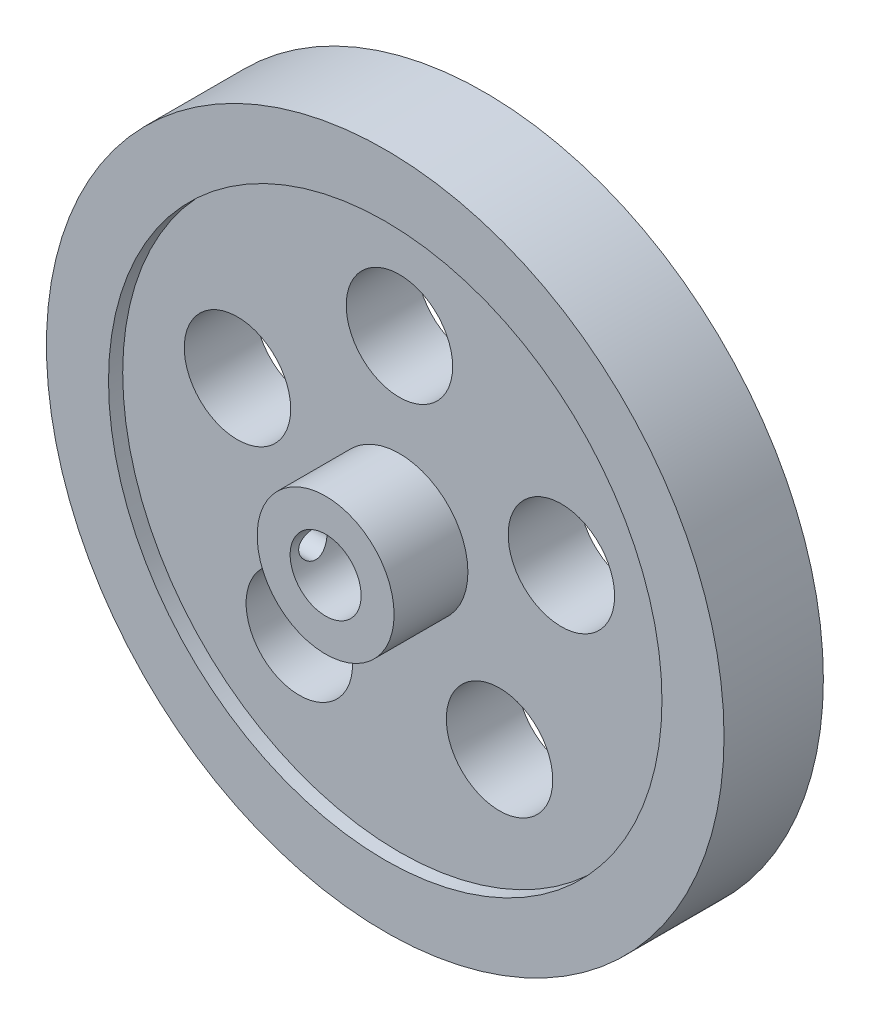
from build123d import *

# Parameters (mm, degrees)
SKETCH_1_R               = 47.75
EXTRUDE_1_DEPTH          = 14
SKETCH_2_R               = 9.65
EXTRUDE_2_DEPTH          = 8.4
SKETCH_3_R               = 5
CUT_EXTRUDE_1_DEPTH      = 22.4
CUT_EXTRUDE_2_REACH      = 73.147
CUT_EXTRUDE_2_END_RADIUS = 9.65
SKETCH_6_R               = 2
CUT_EXTRUDE_START        = -2
SKETCH_7_R               = 39
SKETCH_7_R_2             = 9.65
CUT_EXTRUDE_3_DEPTH      = 2
SKETCH_8_R               = 39
SKETCH_8_R_2             = 9.65
CUT_EXTRUDE_4_DEPTH      = 2
CUT_EXTRUDE_5_REACH      = 70.587
SKETCH_9_R               = 7.5


with BuildPart() as part:
    # 草图1 → 凸台-拉伸1 (new body)
    with BuildSketch(Plane.XY):
        Circle(SKETCH_1_R)
    extrude(amount=EXTRUDE_1_DEPTH)

    # 草图2 → 凸台-拉伸2 (add)
    with BuildSketch(Plane.XY.offset(14)):
        Circle(SKETCH_2_R)
    extrude(amount=EXTRUDE_2_DEPTH)

    # 草图3 → 切除-拉伸1 (cut)
    with BuildSketch(Plane.XY.offset(22.4)):
        Circle(SKETCH_3_R)
    extrude(amount=-CUT_EXTRUDE_1_DEPTH, mode=Mode.SUBTRACT)

    # 切除-拉伸2: up to this cylinder (the profile starts inside it)
    cut_extrude_2_end = Plane(origin=(0, 0, 19.2), z_dir=(0, 0, -1)) * Cylinder(CUT_EXTRUDE_2_END_RADIUS, 166.594, mode=Mode.PRIVATE)
    # 草图6 → 切除-拉伸2 (cut, up to the surface)
    with BuildSketch(Plane(origin=(0, 0, 0), x_dir=(0, 0, -1), z_dir=(1, 0, 0)), mode=Mode.PRIVATE) as cut_extrude_2_sk1:
        with Locations((-19.2, 0)):
            Circle(SKETCH_6_R)
    cut_extrude_2_tool1 = extrude(cut_extrude_2_sk1.sketch, amount=-CUT_EXTRUDE_2_REACH, mode=Mode.PRIVATE) & cut_extrude_2_end
    add(cut_extrude_2_tool1.solids().sort_by_distance((0, 0, 19.2))[0], mode=Mode.SUBTRACT)

    # 草图7 → 切除-拉伸3 (cut)
    with BuildSketch(Plane.XY.offset(14).offset(CUT_EXTRUDE_START)):
        Circle(SKETCH_7_R)
        Circle(SKETCH_7_R_2, mode=Mode.SUBTRACT)
    extrude(amount=CUT_EXTRUDE_3_DEPTH, mode=Mode.SUBTRACT)

    # 草图8 → 切除-拉伸4 (cut)
    with BuildSketch(Plane(origin=(0, 0, 0), x_dir=(-1, 0, 0), z_dir=(0, 0, -1))):
        with Locations(Location((0, 0, 0), (0, 0, 180))):
            Circle(SKETCH_8_R)
        with Locations(Location((0, 0, 0), (0, 0, 180))):
            Circle(SKETCH_8_R_2, mode=Mode.SUBTRACT)
    extrude(amount=-CUT_EXTRUDE_4_DEPTH, mode=Mode.SUBTRACT)

    # 草图9 → 切除-拉伸5 (cut, up to next)
    with BuildSketch(Plane.XY.offset(12), mode=Mode.PRIVATE) as cut_extrude_5_sk1:
        with Locations((0, 24)):
            Circle(SKETCH_9_R)
    cut_extrude_5_tool1 = extrude(cut_extrude_5_sk1.sketch, amount=-CUT_EXTRUDE_5_REACH, mode=Mode.PRIVATE) & part.part
    # 草图9 → 切除-拉伸5 (cut, up to next)
    with BuildSketch(Plane.XY.offset(12), mode=Mode.PRIVATE) as cut_extrude_5_sk2:
        with Locations((22.825356391, 7.416407865)):
            Circle(SKETCH_9_R)
    cut_extrude_5_tool2 = extrude(cut_extrude_5_sk2.sketch, amount=-CUT_EXTRUDE_5_REACH, mode=Mode.PRIVATE) & part.part
    # 草图9 → 切除-拉伸5 (cut, up to next)
    with BuildSketch(Plane.XY.offset(12), mode=Mode.PRIVATE) as cut_extrude_5_sk3:
        with Locations((14.106846055, -19.416407865)):
            Circle(SKETCH_9_R)
    cut_extrude_5_tool3 = extrude(cut_extrude_5_sk3.sketch, amount=-CUT_EXTRUDE_5_REACH, mode=Mode.PRIVATE) & part.part
    # 草图9 → 切除-拉伸5 (cut, up to next)
    with BuildSketch(Plane.XY.offset(12), mode=Mode.PRIVATE) as cut_extrude_5_sk4:
        with Locations((-14.106846055, -19.416407865)):
            Circle(SKETCH_9_R)
    cut_extrude_5_tool4 = extrude(cut_extrude_5_sk4.sketch, amount=-CUT_EXTRUDE_5_REACH, mode=Mode.PRIVATE) & part.part
    # 草图9 → 切除-拉伸5 (cut, up to next)
    with BuildSketch(Plane.XY.offset(12), mode=Mode.PRIVATE) as cut_extrude_5_sk5:
        with Locations((-22.825356391, 7.416407865)):
            Circle(SKETCH_9_R)
    cut_extrude_5_tool5 = extrude(cut_extrude_5_sk5.sketch, amount=-CUT_EXTRUDE_5_REACH, mode=Mode.PRIVATE) & part.part
    add(cut_extrude_5_tool1.solids().sort_by_distance((0, 24, 12))[0], mode=Mode.SUBTRACT)
    add(cut_extrude_5_tool2.solids().sort_by_distance((22.825356, 7.416408, 12))[0], mode=Mode.SUBTRACT)
    add(cut_extrude_5_tool3.solids().sort_by_distance((14.106846, -19.416408, 12))[0], mode=Mode.SUBTRACT)
    add(cut_extrude_5_tool4.solids().sort_by_distance((-14.106846, -19.416408, 12))[0], mode=Mode.SUBTRACT)
    add(cut_extrude_5_tool5.solids().sort_by_distance((-22.825356, 7.416408, 12))[0], mode=Mode.SUBTRACT)


solid = part.part
